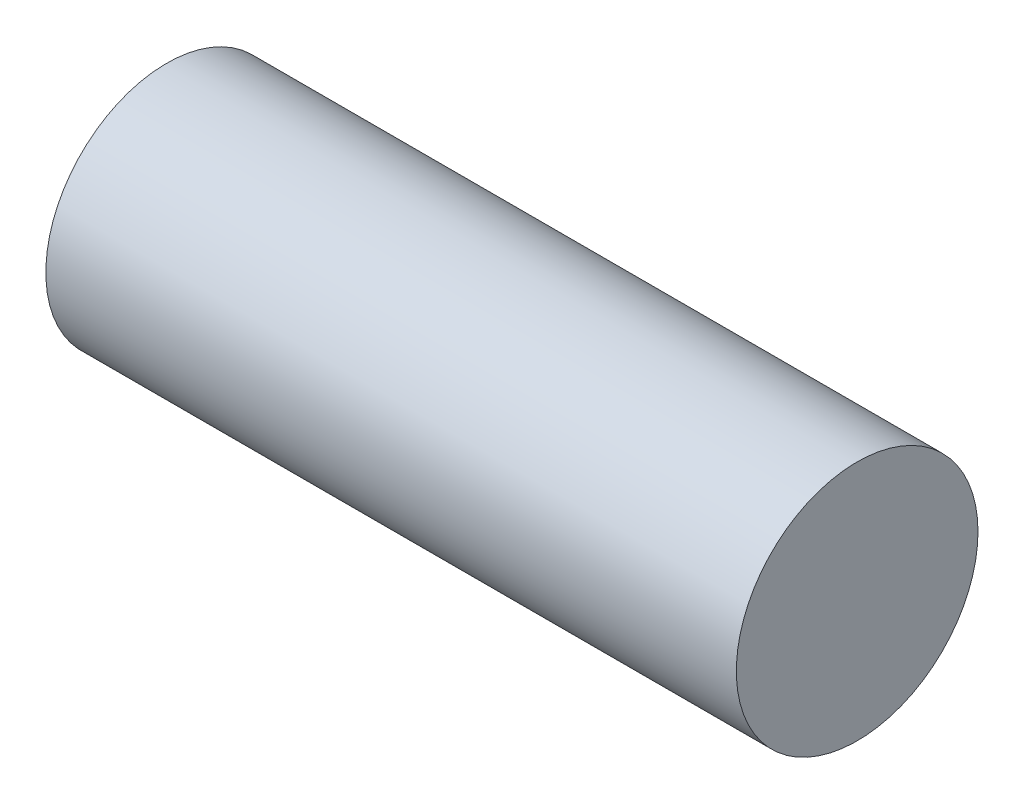
from build123d import *

# Parameters (mm, degrees)
BOSS_EXTRUDE1_START = 200
SKETCH1_R           = 140
BOSS_EXTRUDE1_DEPTH = 800


with BuildPart() as part:
    # Sketch1 → Boss-Extrude1 (new body)
    with BuildSketch(Plane(origin=(0, 0, 0), x_dir=(0, 0, -1), z_dir=(1, 0, 0)).offset(BOSS_EXTRUDE1_START)):
        with Locations((-1640, -80)):
            Circle(SKETCH1_R)
    extrude(amount=BOSS_EXTRUDE1_DEPTH)


solid = part.part
